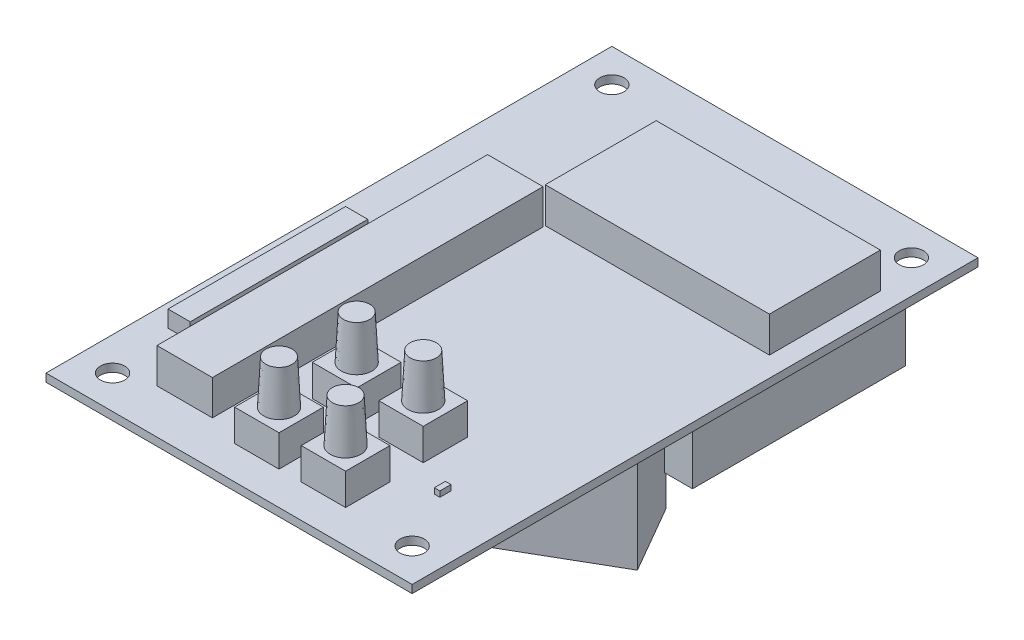
from build123d import *

# Parameters (mm, degrees)
SKETCH1_W                           = 41.91
SKETCH1_H                           = 64.77
BOARD_DEPTH                         = 0.9144
BUTTONBASE_W                        = 5.08
BUTTONBASE_H                        = 5.08
BUTTON_DEPTH                        = 3.6068
SKETCH4_W                           = 25.654
SKETCH4_H                           = 12.7
LIPO_DEPTH                          = 4.064
F_7_64_0_10938_DIAMETER_HOLE1_D     = 2.778252
F_7_64_0_10938_DIAMETER_HOLE1_DEPTH = 25.4
F_7_64_0_10938_DIAMETER_HOLE1_TIP   = 0.834671108
SKETCH8_W                           = 0.635
SKETCH8_H                           = 1.27
LED_DEPTH                           = 0.635
POWERJACK_DEPTH                     = 10.9982
XBEE_DEPTH                          = 7.09
SKETCH12_R                          = 1.7526
BUTTONPLUNGER_DEPTH                 = 5
PLUNGER_TAPER_ANGLE                 = 2.87
SKETCH13_W                          = 6.35
SKETCH13_H                          = 37.846
ATMEL_DEPTH                         = 4
HEADERS_DEPTH                       = 8.89
HEADERS_DEPTH_BACK                  = 2.8194
SKETCH15_W                          = 2.54
SKETCH15_H                          = 20.32


with BuildPart() as part:
    # Sketch1 → Board (new body)
    with BuildSketch(Plane(origin=(0, 0, 0), x_dir=(1, 0, 0), z_dir=(0, 1, 0))):
        with Locations((20.955, 32.385)):
            Rectangle(SKETCH1_W, SKETCH1_H)
    extrude(amount=BOARD_DEPTH)

    # ButtonBase → Button (add)
    with BuildSketch(Plane(origin=(0, 0.9144, 0), x_dir=(1, 0, 0), z_dir=(0, 1, 0))):
        with Locations((20.32, 15.24)):
            Rectangle(BUTTONBASE_W, BUTTONBASE_H)
        with Locations((27.94, 15.24)):
            Rectangle(BUTTONBASE_W, BUTTONBASE_H)
        with Locations((27.94, 6.35)):
            Rectangle(BUTTONBASE_W, BUTTONBASE_H)
        with Locations((20.32, 6.35)):
            Rectangle(BUTTONBASE_W, BUTTONBASE_H)
    extrude(amount=BUTTON_DEPTH)

    # Sketch4 → LiPo (add)
    with BuildSketch(Plane(origin=(0, 0.9144, 0), x_dir=(1, 0, 0), z_dir=(0, 1, 0))):
        with Locations((26.797, 49.53)):
            Rectangle(SKETCH4_W, SKETCH4_H)
    extrude(amount=LIPO_DEPTH)

    # 7/64 (0.10938) Diameter Hole1
    with Locations(Plane(origin=(0, 0.9144, 0), x_dir=(1, 0, 0), z_dir=(0, 1, 0))):
        with Locations((3.81, 60.96), (38.1, 60.96), (38.1, 3.81), (3.81, 3.81)):
            Hole(F_7_64_0_10938_DIAMETER_HOLE1_D / 2, depth=F_7_64_0_10938_DIAMETER_HOLE1_DEPTH)
            with Locations((0, 0, -(F_7_64_0_10938_DIAMETER_HOLE1_DEPTH + F_7_64_0_10938_DIAMETER_HOLE1_TIP / 2))):  # 118° drill point
                Cone(0, F_7_64_0_10938_DIAMETER_HOLE1_D / 2, F_7_64_0_10938_DIAMETER_HOLE1_TIP, mode=Mode.SUBTRACT)

    # Sketch8 → LED (add)
    with BuildSketch(Plane(origin=(0, 0.9144, 0), x_dir=(1, 0, 0), z_dir=(0, 1, 0))):
        with Locations((34.544, 10.8585)):
            Rectangle(SKETCH8_W, SKETCH8_H)
    extrude(amount=LED_DEPTH)

    # Sketch10 → PowerJack (add)
    with BuildSketch(Plane.XZ):
        Polygon((41.478212841, -26.21822299), (28.9179, -18.96652299), (24.4221, -26.75347701), (36.982412841, -34.00517701), align=None)
    extrude(amount=POWERJACK_DEPTH)

    # Sketch11 → XBee (add)
    with BuildSketch(Plane.XZ):
        Polygon((19.3929, -57.912), (12.8651, -50.3174), (12.8651, -41.1226), (19.3929, -33.528), (40.4749, -33.528), (40.4749, -57.912), align=None)
    extrude(amount=XBEE_DEPTH)

    # Sketch12 → ButtonPlunger (add)
    with BuildSketch(Plane(origin=(0, 4.5212, 0), x_dir=(1, 0, 0), z_dir=(0, 1, 0))):
        with Locations(Location((20.32, 15.24, 0), (0, 0, 90))):
            Circle(SKETCH12_R)
        with Locations(Location((27.94, 15.24, 0), (0, 0, 270))):
            Circle(SKETCH12_R)
        with Locations(Location((27.94, 6.35, 0), (0, 0, 270))):
            Circle(SKETCH12_R)
        with Locations(Location((20.32, 6.35, 0), (0, 0, 270))):
            Circle(SKETCH12_R)
    extrude(amount=BUTTONPLUNGER_DEPTH)

    # Plunger Taper
    plunger_taper_faces = [part.faces().sort_by_distance(p)[0] for p in [
        (27.94, 7.0212, -8.1026),
        (27.94, 7.0212, -16.9926),
        (20.32, 7.0212, -13.4874),
        (20.32, 7.0212, -8.1026),
    ]]
    draft(plunger_taper_faces, Plane.ZX.offset(4.5212), PLUNGER_TAPER_ANGLE)

    # Sketch13 → ATMEL (add)
    with BuildSketch(Plane(origin=(0, 0.9144, 0), x_dir=(1, 0, 0), z_dir=(0, 1, 0))):
        with Locations((10.795, 24.003)):
            Rectangle(SKETCH13_W, SKETCH13_H)
    extrude(amount=ATMEL_DEPTH)

    # Sketch15 → Headers (add, two sides: drawn at the far end of the back side and taken through both)
    with BuildSketch(Plane(origin=(0, 0, 0), x_dir=(-1, 0, 0), z_dir=(0, -1, 0)).offset(-HEADERS_DEPTH_BACK)):
        with Locations((-3.81, 21.59)):
            Rectangle(SKETCH15_W, SKETCH15_H)
    extrude(amount=HEADERS_DEPTH + HEADERS_DEPTH_BACK)


solid = part.part
